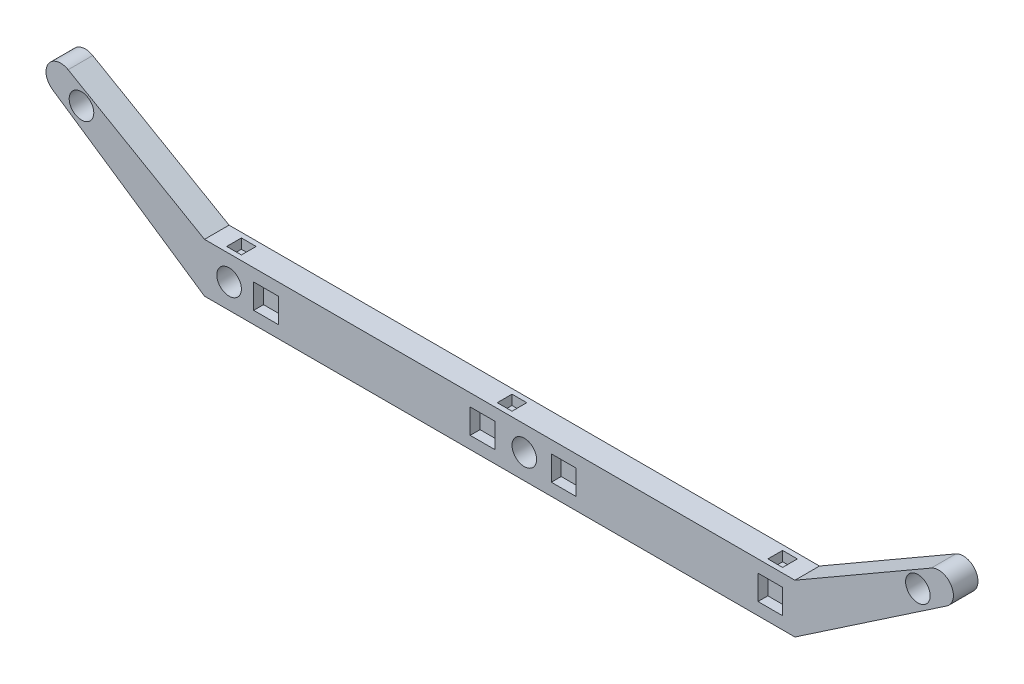
from build123d import *

# Parameters (mm, degrees)
BOSS_EXTRUDE1_DEPTH      = 600
BOSS_EXTRUDE1_DEPTH_BACK = 600
SKETCH1_W                = 50
SKETCH1_H                = 100
BOSS_EXTRUDE2_DEPTH      = 50
SKETCH3_R                = 25
CUT_EXTRUDE1_DEPTH       = 50
SKETCH4_R                = 25
CUT_EXTRUDE2_DEPTH       = 948.9580797
SKETCH5_W                = 50
SKETCH5_H                = 50
CUT_EXTRUDE3_DEPTH       = 20
SKETCH6_W                = 30
SKETCH6_H                = 30
CUT_EXTRUDE4_DEPTH       = 20


with BuildPart() as part:
    # Sketch1 → Boss-Extrude1 (new, two sides: drawn at the far end of the back side and taken through both)
    with BuildSketch(Plane(origin=(0, 0, 0), x_dir=(0, 0, -1), z_dir=(1, 0, 0)).offset(-BOSS_EXTRUDE1_DEPTH_BACK)):
        Rectangle(SKETCH1_W, SKETCH1_H)
    extrude(amount=BOSS_EXTRUDE1_DEPTH + BOSS_EXTRUDE1_DEPTH_BACK)

    # Sketch2 → Boss-Extrude2 (add)
    with BuildSketch(Plane.XY.offset(25)):
        with BuildLine():
            Line((600, 50), (877.128129211, 210))
            ThreePointArc((877.128129211, 210), (917.555611759, 199.939135225), (908.947540593, 159.177591388))
            Line((908.947540593, 159.177591388), (600, -50))
            Line((600, -50), (600, 50))
        make_face()
        with BuildLine():
            Line((-600, 50), (-600, -50))
            Line((-600, -50), (-908.947540593, 159.177591388))
            ThreePointArc((-908.947540593, 159.177591388), (-917.555611759, 199.939135225), (-877.128129211, 210))
            Line((-877.128129211, 210), (-600, 50))
        make_face()
    extrude(amount=-BOSS_EXTRUDE2_DEPTH)

    # Sketch3 → Cut-Extrude1 (cut)
    with BuildSketch(Plane.XY.offset(25)):
        with Locations((-850, 160)):
            Circle(SKETCH3_R)
        with Locations((850, 160)):
            Circle(SKETCH3_R)
    extrude(amount=-CUT_EXTRUDE1_DEPTH, mode=Mode.SUBTRACT)

    # Sketch4 → Cut-Extrude2 (cut, through all)
    with BuildSketch(Plane.XY.offset(25)):
        with Locations((50, 0)):
            Circle(SKETCH4_R)
        with Locations((-550, 0)):
            Circle(SKETCH4_R)
    extrude(amount=-CUT_EXTRUDE2_DEPTH, mode=Mode.SUBTRACT)

    # Sketch5 → Cut-Extrude3 (cut)
    with BuildSketch(Plane.XY.offset(25)):
        with Locations((-35, 0)):
            Rectangle(SKETCH5_W, SKETCH5_H)
        with Locations((-475, 0)):
            Rectangle(SKETCH5_W, SKETCH5_H)
        with Locations((130, 0)):
            Rectangle(SKETCH5_W, SKETCH5_H)
        with Locations((550, 0)):
            Rectangle(SKETCH5_W, SKETCH5_H)
    extrude(amount=-CUT_EXTRUDE3_DEPTH, mode=Mode.SUBTRACT)

    # Sketch6 → Cut-Extrude4 (cut)
    with BuildSketch(Plane(origin=(0, 50, 0), x_dir=(1, 0, 0), z_dir=(0, 1, 0))):
        with Locations((550, 0)):
            Rectangle(SKETCH6_W, SKETCH6_H)
        with Locations((-550, 0)):
            Rectangle(SKETCH6_W, SKETCH6_H)
        Rectangle(SKETCH6_W, SKETCH6_H)
    extrude(amount=-CUT_EXTRUDE4_DEPTH, mode=Mode.SUBTRACT)


solid = part.part
